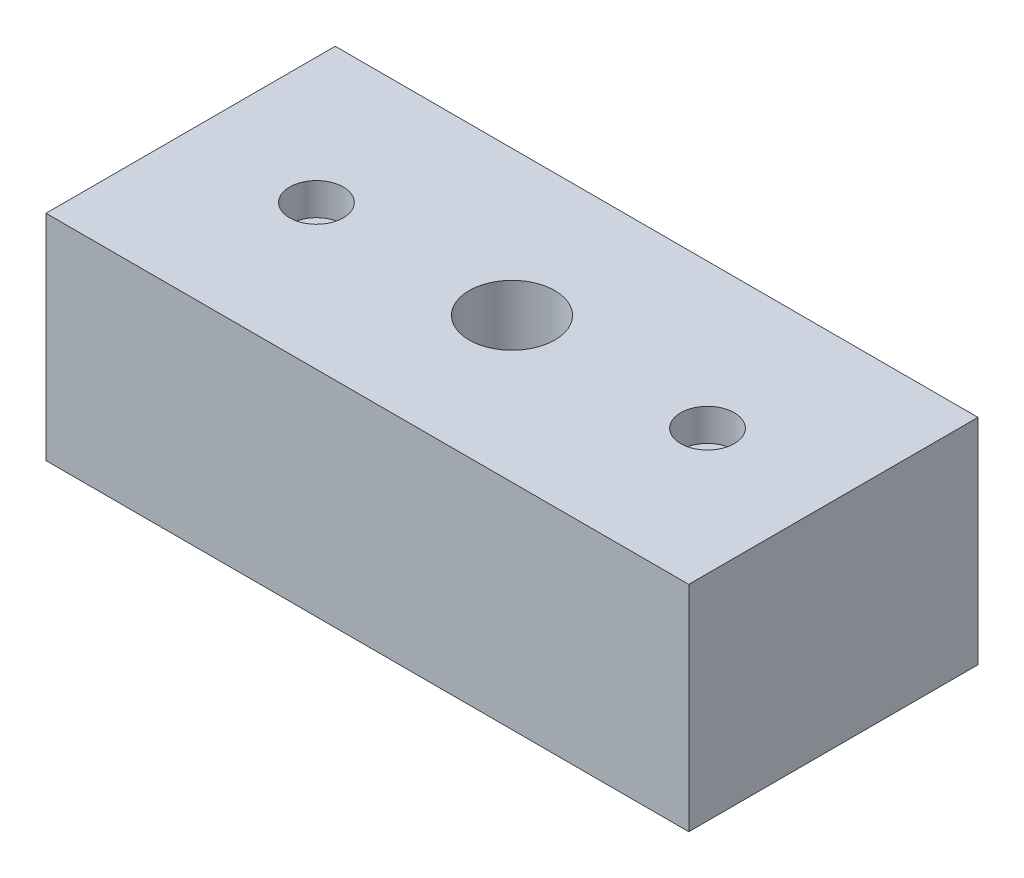
from build123d import *

# Parameters (mm, degrees)
SKETCH2_W           = 60
SKETCH2_H           = 20
BOSS_EXTRUDE1_DEPTH = 13.5
SKETCH3_R           = 2.5
CUT_EXTRUDE1_DEPTH  = 3
SKETCH4_R           = 4
CUT_EXTRUDE2_DEPTH  = 39.5


with BuildPart() as part:
    # Sketch2 → Boss-Extrude1 (new, symmetric)
    with BuildSketch(Plane.XY):
        Rectangle(SKETCH2_W, SKETCH2_H)
    extrude(amount=BOSS_EXTRUDE1_DEPTH, both=True)

    # Sketch3 → Cut-Extrude1 (cut)
    with BuildSketch(Plane(origin=(0, 10, 0), x_dir=(1, 0, 0), z_dir=(0, 1, 0))):
        with Locations(Location((-18.25, 0, 0), (0, 0, 270))):
            Circle(SKETCH3_R)
        with Locations(Location((18.25, 0, 0), (0, 0, 90))):
            Circle(SKETCH3_R)
    extrude(amount=-CUT_EXTRUDE1_DEPTH, mode=Mode.SUBTRACT)

    # Sketch4 → Cut-Extrude2 (cut, through all)
    with BuildSketch(Plane(origin=(0, 10, 0), x_dir=(1, 0, 0), z_dir=(0, 1, 0))):
        with Locations(Location((0, 0, 0), (0, 0, 270))):
            Circle(SKETCH4_R)
    extrude(amount=-CUT_EXTRUDE2_DEPTH, mode=Mode.SUBTRACT)


solid = part.part
